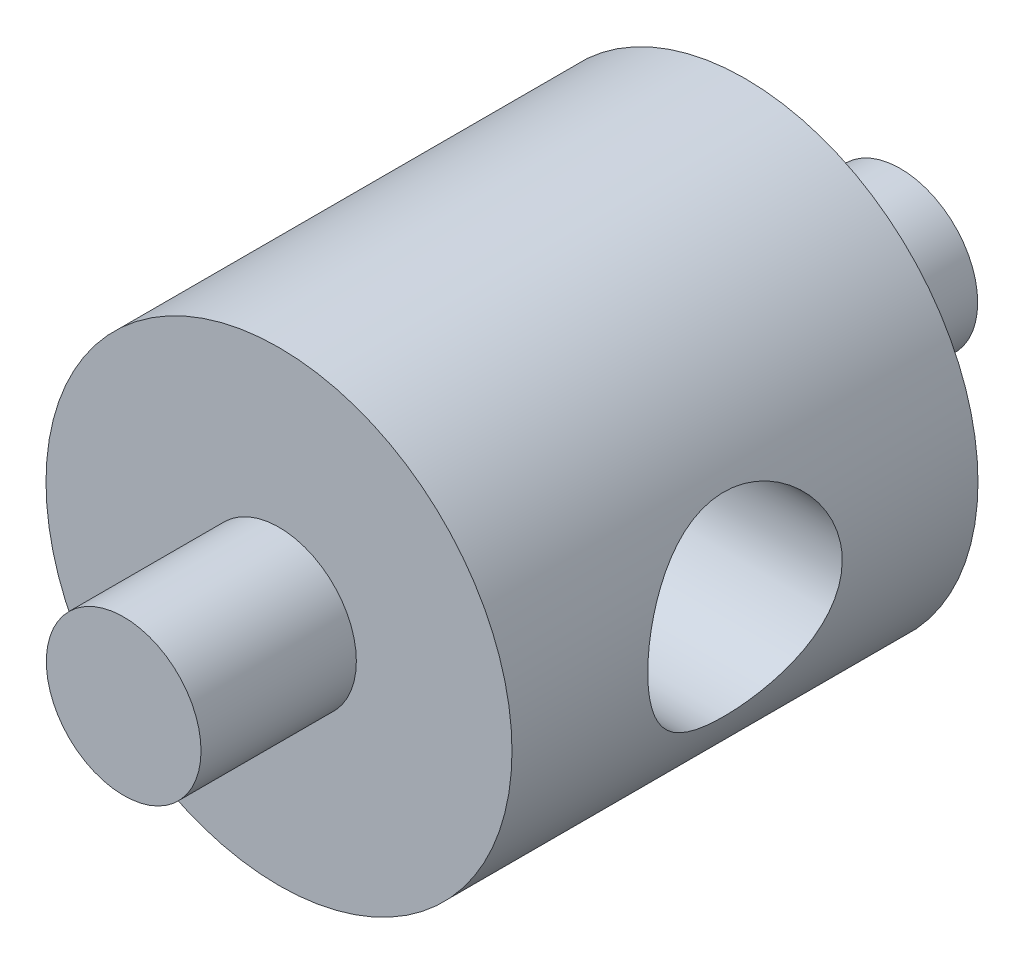
from build123d import *

# Parameters (mm, degrees)
SKETCH1_R                = 9.525
BOSS_EXTRUDE1_DEPTH      = 19.05
BOSS_EXTRUDE2_DEPTH      = 6.35
BOSS_EXTRUDE2_DEPTH_BACK = 25.4
SKETCH2_R                = 3.1623
CUT_EXTRUDE1_DEPTH       = 29.750847814
CUT_EXTRUDE1_DEPTH_BACK  = 29.750847814
SKETCH3_R                = 3.9751


with BuildPart() as part:
    # Sketch1 → Boss-Extrude1 (new body)
    with BuildSketch(Plane.XY):
        with Locations(Location((0, 0, 0), (0, 0, 180))):
            Circle(SKETCH1_R)
    extrude(amount=BOSS_EXTRUDE1_DEPTH)

    # Sketch2 → Boss-Extrude2 (add, two sides: drawn at the far end of the back side and taken through both)
    with BuildSketch(Plane.XY.offset(19.05).offset(-BOSS_EXTRUDE2_DEPTH_BACK)):
        Circle(SKETCH2_R)
    extrude(amount=BOSS_EXTRUDE2_DEPTH + BOSS_EXTRUDE2_DEPTH_BACK)

    # Sketch3 → Cut-Extrude1 (cut, two sides: drawn at the far end of the back side and taken through both)
    with BuildSketch(Plane(origin=(0, 0, 0), x_dir=(0, 0, -1), z_dir=(1, 0, 0)).offset(-CUT_EXTRUDE1_DEPTH_BACK)):
        with Locations((-9.525, 0)):
            Circle(SKETCH3_R)
    extrude(amount=CUT_EXTRUDE1_DEPTH + CUT_EXTRUDE1_DEPTH_BACK, mode=Mode.SUBTRACT)


solid = part.part
